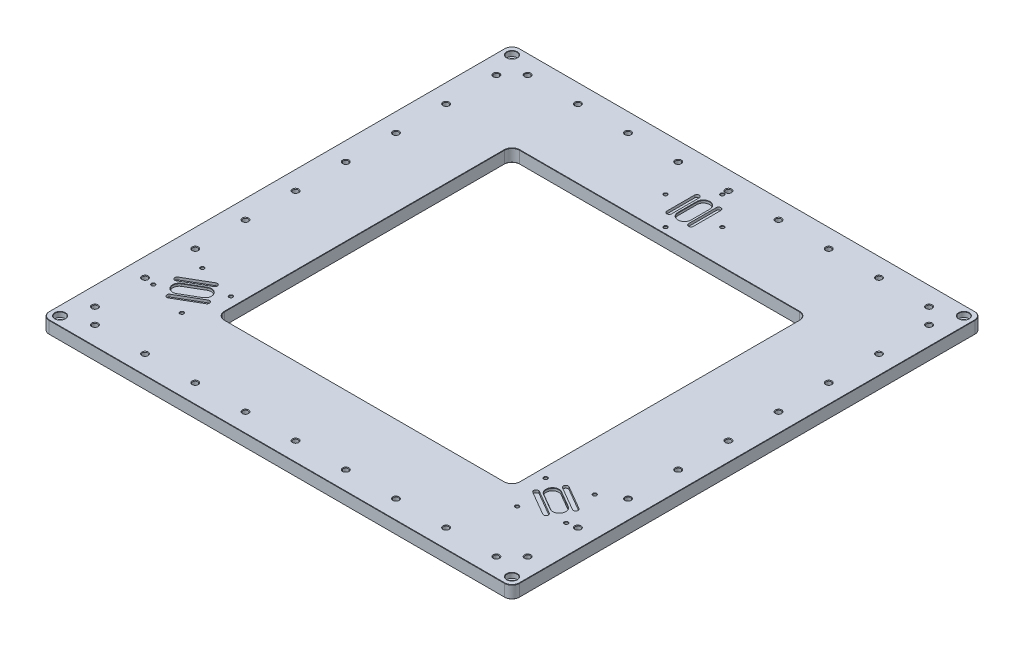
from build123d import *

# Parameters (mm, degrees)
SKETCH1_W                       = 375
SKETCH1_H                       = 375
BOSS_EXTRUDE1_DEPTH             = 10
CBORE_FOR_M4_SHCS1_D            = 4.3
CBORE_FOR_M4_SHCS1_CBORE_D      = 8
CBORE_FOR_M4_SHCS1_CBORE_DEPTH  = 4
M5X0_8_TAPPED_HOLE1_AT_2_COUNT  = 2
M5X0_8_TAPPED_HOLE1_AT_2_PITCH  = 235.279089594
M5X0_8_TAPPED_HOLE1_AT_3_COUNT  = 2
M5X0_8_TAPPED_HOLE1_AT_3_PITCH  = 210.133885892
M5X0_8_TAPPED_HOLE1_AT_4_COUNT  = 2
M5X0_8_TAPPED_HOLE1_AT_4_PITCH  = 190.147968698
M5X0_8_TAPPED_HOLE1_AT_5_COUNT  = 2
M5X0_8_TAPPED_HOLE1_AT_5_PITCH  = 177.07696067
M5X0_8_TAPPED_HOLE1_AT_6_COUNT  = 2
M5X0_8_TAPPED_HOLE1_AT_6_PITCH  = 172.5
M5X0_8_TAPPED_HOLE1_AT_7_COUNT  = 2
M5X0_8_TAPPED_HOLE1_AT_7_PITCH  = 177.07696067
M5X0_8_TAPPED_HOLE1_AT_8_COUNT  = 2
M5X0_8_TAPPED_HOLE1_AT_8_PITCH  = 190.147968698
M5X0_8_TAPPED_HOLE1_AT_9_COUNT  = 2
M5X0_8_TAPPED_HOLE1_AT_9_PITCH  = 210.133885892
M5X0_8_TAPPED_HOLE1_AT_10_COUNT = 2
M5X0_8_TAPPED_HOLE1_AT_10_PITCH = 235.279089594
CIRPATTERN1_COUNT               = 4
CUT_EXTRUDE2_DEPTH              = 2
SKETCH5_W                       = 235
SKETCH5_H                       = 235
CUT_EXTRUDE3_DEPTH              = 10
M3X0_5_TAPPED_HOLE1_D           = 2.5
M3X0_5_TAPPED_HOLE1_CSINK_D     = 3.05
M3X0_5_TAPPED_HOLE1_CSINK_ANGLE = 90
CUT_EXTRUDE4_DEPTH              = 2
FILLET2_R                       = 6
CHAMFER1_SIZE                   = 0.25


with BuildPart() as part:
    # Sketch1 → Boss-Extrude1 (new body)
    with BuildSketch(Plane(origin=(0, 0, 0), x_dir=(1, 0, 0), z_dir=(0, 1, 0))):
        Rectangle(SKETCH1_W, SKETCH1_H)
    extrude(amount=BOSS_EXTRUDE1_DEPTH)

    # CBORE for M4 SHCS1 (through all)
    with Locations(Plane(origin=(0, 10, 0), x_dir=(1, 0, 0), z_dir=(0, 1, 0))):
        with Locations((-180.121825, -180.121825)):
            cbore_for_m4_shcs1 = CounterBoreHole(CBORE_FOR_M4_SHCS1_D / 2, CBORE_FOR_M4_SHCS1_CBORE_D / 2, CBORE_FOR_M4_SHCS1_CBORE_DEPTH)

    # Sketch16 → M5x0.8 Tapped Hole1 (revolve, cut)
    with BuildSketch(Plane(origin=(0, 10, 0), x_dir=(0, 0, 1), z_dir=(1, 0, 0))):
        Polygon((0, 0), (0, 10), (2.525, 10), (2.1, 9.575), (2.1, 0.425), (2.525, 0), align=None)
    m5x0_8_tapped_hole1 = revolve(axis=Axis((0, 16.35, 0), (0, -1, 0)), mode=Mode.SUBTRACT)

    # M5x0.8 Tapped Hole1 at 2: M5x0.8 Tapped Hole1 ×2
    with Locations(*[Vector(-0.6800434338485409, 0, -0.7331718271179581) * (i * M5X0_8_TAPPED_HOLE1_AT_2_PITCH) for i in range(1, M5X0_8_TAPPED_HOLE1_AT_2_COUNT)]):
        add(m5x0_8_tapped_hole1, mode=Mode.SUBTRACT)

    # M5x0.8 Tapped Hole1 at 3: M5x0.8 Tapped Hole1 ×2
    with Locations(*[Vector(-0.5710644881985998, 0, -0.8209052017854872) * (i * M5X0_8_TAPPED_HOLE1_AT_3_PITCH) for i in range(1, M5X0_8_TAPPED_HOLE1_AT_3_COUNT)]):
        add(m5x0_8_tapped_hole1, mode=Mode.SUBTRACT)

    # M5x0.8 Tapped Hole1 at 4: M5x0.8 Tapped Hole1 ×2
    with Locations(*[Vector(-0.42072497827747996, 0, -0.9071882344108162) * (i * M5X0_8_TAPPED_HOLE1_AT_4_PITCH) for i in range(1, M5X0_8_TAPPED_HOLE1_AT_4_COUNT)]):
        add(m5x0_8_tapped_hole1, mode=Mode.SUBTRACT)

    # M5x0.8 Tapped Hole1 at 5: M5x0.8 Tapped Hole1 ×2
    with Locations(*[Vector(-0.22589048201828704, 0, -0.9741527037038629) * (i * M5X0_8_TAPPED_HOLE1_AT_5_PITCH) for i in range(1, M5X0_8_TAPPED_HOLE1_AT_5_COUNT)]):
        add(m5x0_8_tapped_hole1, mode=Mode.SUBTRACT)

    # M5x0.8 Tapped Hole1 at 6: M5x0.8 Tapped Hole1 ×2
    with Locations(*[(0, 0, -i * M5X0_8_TAPPED_HOLE1_AT_6_PITCH) for i in range(1, M5X0_8_TAPPED_HOLE1_AT_6_COUNT)]):
        add(m5x0_8_tapped_hole1, mode=Mode.SUBTRACT)

    # M5x0.8 Tapped Hole1 at 7: M5x0.8 Tapped Hole1 ×2
    with Locations(*[Vector(0.22589048201828704, 0, -0.9741527037038629) * (i * M5X0_8_TAPPED_HOLE1_AT_7_PITCH) for i in range(1, M5X0_8_TAPPED_HOLE1_AT_7_COUNT)]):
        add(m5x0_8_tapped_hole1, mode=Mode.SUBTRACT)

    # M5x0.8 Tapped Hole1 at 8: M5x0.8 Tapped Hole1 ×2
    with Locations(*[Vector(0.42072497827747996, 0, -0.9071882344108162) * (i * M5X0_8_TAPPED_HOLE1_AT_8_PITCH) for i in range(1, M5X0_8_TAPPED_HOLE1_AT_8_COUNT)]):
        add(m5x0_8_tapped_hole1, mode=Mode.SUBTRACT)

    # M5x0.8 Tapped Hole1 at 9: M5x0.8 Tapped Hole1 ×2
    with Locations(*[Vector(0.5710644881985997, 0, -0.8209052017854872) * (i * M5X0_8_TAPPED_HOLE1_AT_9_PITCH) for i in range(1, M5X0_8_TAPPED_HOLE1_AT_9_COUNT)]):
        add(m5x0_8_tapped_hole1, mode=Mode.SUBTRACT)

    # M5x0.8 Tapped Hole1 at 10: M5x0.8 Tapped Hole1 ×2
    with Locations(*[Vector(0.6800434338485409, 0, -0.7331718271179581) * (i * M5X0_8_TAPPED_HOLE1_AT_10_PITCH) for i in range(1, M5X0_8_TAPPED_HOLE1_AT_10_COUNT)]):
        add(m5x0_8_tapped_hole1, mode=Mode.SUBTRACT)

    # CirPattern1: CBORE for M4 SHCS1, M5x0.8 Tapped Hole1 ×4 about axis
    cirpattern1_axis = Axis((0, 0, 0), (0, 1, 0))
    add([cbore_for_m4_shcs1.rotate(cirpattern1_axis, i * 360 / CIRPATTERN1_COUNT) for i in range(1, CIRPATTERN1_COUNT)], mode=Mode.SUBTRACT)
    add([m5x0_8_tapped_hole1.rotate(cirpattern1_axis, i * 360 / CIRPATTERN1_COUNT) for i in range(1, CIRPATTERN1_COUNT)], mode=Mode.SUBTRACT)

    # CirPattern1 copy 1 sketch → CirPattern1 copy 1 (revolve, cut)
    with BuildSketch(Plane(origin=(-172.5, 10, 160), x_dir=(1, 0, 0), z_dir=(0, 0, -1))):
        Polygon((0, 0), (0, 10), (2.525, 10), (2.1, 9.575), (2.1, 0.425), (2.525, 0), align=None)
    revolve(axis=Axis((-172.5, 16.35, 160), (0, -1, 0)), mode=Mode.SUBTRACT)

    # CirPattern1 copy 2 sketch → CirPattern1 copy 2 (revolve, cut)
    with BuildSketch(Plane(origin=(160, 10, 172.5), x_dir=(0, 0, -1), z_dir=(-1, 0, 0))):
        Polygon((0, 0), (0, 10), (2.525, 10), (2.1, 9.575), (2.1, 0.425), (2.525, 0), align=None)
    revolve(axis=Axis((160, 16.35, 172.5), (0, -1, 0)), mode=Mode.SUBTRACT)

    # CirPattern1 copy 3 sketch → CirPattern1 copy 3 (revolve, cut)
    with BuildSketch(Plane(origin=(172.5, 10, -160), x_dir=(-1, 0, 0), z_dir=(0, 0, 1))):
        Polygon((0, 0), (0, 10), (2.525, 10), (2.1, 9.575), (2.1, 0.425), (2.525, 0), align=None)
    revolve(axis=Axis((172.5, 16.35, -160), (0, -1, 0)), mode=Mode.SUBTRACT)

    # CirPattern1 copy 4 sketch → CirPattern1 copy 4 (revolve, cut)
    with BuildSketch(Plane(origin=(-172.5, 10, 120), x_dir=(1, 0, 0), z_dir=(0, 0, -1))):
        Polygon((0, 0), (0, 10), (2.525, 10), (2.1, 9.575), (2.1, 0.425), (2.525, 0), align=None)
    revolve(axis=Axis((-172.5, 16.35, 120), (0, -1, 0)), mode=Mode.SUBTRACT)

    # CirPattern1 copy 5 sketch → CirPattern1 copy 5 (revolve, cut)
    with BuildSketch(Plane(origin=(120, 10, 172.5), x_dir=(0, 0, -1), z_dir=(-1, 0, 0))):
        Polygon((0, 0), (0, 10), (2.525, 10), (2.1, 9.575), (2.1, 0.425), (2.525, 0), align=None)
    revolve(axis=Axis((120, 16.35, 172.5), (0, -1, 0)), mode=Mode.SUBTRACT)

    # CirPattern1 copy 6 sketch → CirPattern1 copy 6 (revolve, cut)
    with BuildSketch(Plane(origin=(172.5, 10, -120), x_dir=(-1, 0, 0), z_dir=(0, 0, 1))):
        Polygon((0, 0), (0, 10), (2.525, 10), (2.1, 9.575), (2.1, 0.425), (2.525, 0), align=None)
    revolve(axis=Axis((172.5, 16.35, -120), (0, -1, 0)), mode=Mode.SUBTRACT)

    # CirPattern1 copy 7 sketch → CirPattern1 copy 7 (revolve, cut)
    with BuildSketch(Plane(origin=(-172.5, 10, 80), x_dir=(1, 0, 0), z_dir=(0, 0, -1))):
        Polygon((0, 0), (0, 10), (2.525, 10), (2.1, 9.575), (2.1, 0.425), (2.525, 0), align=None)
    revolve(axis=Axis((-172.5, 16.35, 80), (0, -1, 0)), mode=Mode.SUBTRACT)

    # CirPattern1 copy 8 sketch → CirPattern1 copy 8 (revolve, cut)
    with BuildSketch(Plane(origin=(80, 10, 172.5), x_dir=(0, 0, -1), z_dir=(-1, 0, 0))):
        Polygon((0, 0), (0, 10), (2.525, 10), (2.1, 9.575), (2.1, 0.425), (2.525, 0), align=None)
    revolve(axis=Axis((80, 16.35, 172.5), (0, -1, 0)), mode=Mode.SUBTRACT)

    # CirPattern1 copy 9 sketch → CirPattern1 copy 9 (revolve, cut)
    with BuildSketch(Plane(origin=(172.5, 10, -80), x_dir=(-1, 0, 0), z_dir=(0, 0, 1))):
        Polygon((0, 0), (0, 10), (2.525, 10), (2.1, 9.575), (2.1, 0.425), (2.525, 0), align=None)
    revolve(axis=Axis((172.5, 16.35, -80), (0, -1, 0)), mode=Mode.SUBTRACT)

    # CirPattern1 copy 10 sketch → CirPattern1 copy 10 (revolve, cut)
    with BuildSketch(Plane(origin=(-172.5, 10, 40), x_dir=(1, 0, 0), z_dir=(0, 0, -1))):
        Polygon((0, 0), (0, 10), (2.525, 10), (2.1, 9.575), (2.1, 0.425), (2.525, 0), align=None)
    revolve(axis=Axis((-172.5, 16.35, 40), (0, -1, 0)), mode=Mode.SUBTRACT)

    # CirPattern1 copy 11 sketch → CirPattern1 copy 11 (revolve, cut)
    with BuildSketch(Plane(origin=(40, 10, 172.5), x_dir=(0, 0, -1), z_dir=(-1, 0, 0))):
        Polygon((0, 0), (0, 10), (2.525, 10), (2.1, 9.575), (2.1, 0.425), (2.525, 0), align=None)
    revolve(axis=Axis((40, 16.35, 172.5), (0, -1, 0)), mode=Mode.SUBTRACT)

    # CirPattern1 copy 12 sketch → CirPattern1 copy 12 (revolve, cut)
    with BuildSketch(Plane(origin=(172.5, 10, -40), x_dir=(-1, 0, 0), z_dir=(0, 0, 1))):
        Polygon((0, 0), (0, 10), (2.525, 10), (2.1, 9.575), (2.1, 0.425), (2.525, 0), align=None)
    revolve(axis=Axis((172.5, 16.35, -40), (0, -1, 0)), mode=Mode.SUBTRACT)

    # CirPattern1 copy 13 sketch → CirPattern1 copy 13 (revolve, cut)
    with BuildSketch(Plane(origin=(-172.5, 10, 0), x_dir=(1, 0, 0), z_dir=(0, 0, -1))):
        Polygon((0, 0), (0, 10), (2.525, 10), (2.1, 9.575), (2.1, 0.425), (2.525, 0), align=None)
    revolve(axis=Axis((-172.5, 16.35, 0), (0, -1, 0)), mode=Mode.SUBTRACT)

    # CirPattern1 copy 14 sketch → CirPattern1 copy 14 (revolve, cut)
    with BuildSketch(Plane(origin=(0, 10, 172.5), x_dir=(0, 0, -1), z_dir=(-1, 0, 0))):
        Polygon((0, 0), (0, 10), (2.525, 10), (2.1, 9.575), (2.1, 0.425), (2.525, 0), align=None)
    revolve(axis=Axis((0, 16.35, 172.5), (0, -1, 0)), mode=Mode.SUBTRACT)

    # CirPattern1 copy 15 sketch → CirPattern1 copy 15 (revolve, cut)
    with BuildSketch(Plane(origin=(172.5, 10, 0), x_dir=(-1, 0, 0), z_dir=(0, 0, 1))):
        Polygon((0, 0), (0, 10), (2.525, 10), (2.1, 9.575), (2.1, 0.425), (2.525, 0), align=None)
    revolve(axis=Axis((172.5, 16.35, 0), (0, -1, 0)), mode=Mode.SUBTRACT)

    # CirPattern1 copy 16 sketch → CirPattern1 copy 16 (revolve, cut)
    with BuildSketch(Plane(origin=(-172.5, 10, -40), x_dir=(1, 0, 0), z_dir=(0, 0, -1))):
        Polygon((0, 0), (0, 10), (2.525, 10), (2.1, 9.575), (2.1, 0.425), (2.525, 0), align=None)
    revolve(axis=Axis((-172.5, 16.35, -40), (0, -1, 0)), mode=Mode.SUBTRACT)

    # CirPattern1 copy 17 sketch → CirPattern1 copy 17 (revolve, cut)
    with BuildSketch(Plane(origin=(-40, 10, 172.5), x_dir=(0, 0, -1), z_dir=(-1, 0, 0))):
        Polygon((0, 0), (0, 10), (2.525, 10), (2.1, 9.575), (2.1, 0.425), (2.525, 0), align=None)
    revolve(axis=Axis((-40, 16.35, 172.5), (0, -1, 0)), mode=Mode.SUBTRACT)

    # CirPattern1 copy 18 sketch → CirPattern1 copy 18 (revolve, cut)
    with BuildSketch(Plane(origin=(172.5, 10, 40), x_dir=(-1, 0, 0), z_dir=(0, 0, 1))):
        Polygon((0, 0), (0, 10), (2.525, 10), (2.1, 9.575), (2.1, 0.425), (2.525, 0), align=None)
    revolve(axis=Axis((172.5, 16.35, 40), (0, -1, 0)), mode=Mode.SUBTRACT)

    # CirPattern1 copy 19 sketch → CirPattern1 copy 19 (revolve, cut)
    with BuildSketch(Plane(origin=(-172.5, 10, -80), x_dir=(1, 0, 0), z_dir=(0, 0, -1))):
        Polygon((0, 0), (0, 10), (2.525, 10), (2.1, 9.575), (2.1, 0.425), (2.525, 0), align=None)
    revolve(axis=Axis((-172.5, 16.35, -80), (0, -1, 0)), mode=Mode.SUBTRACT)

    # CirPattern1 copy 20 sketch → CirPattern1 copy 20 (revolve, cut)
    with BuildSketch(Plane(origin=(-80, 10, 172.5), x_dir=(0, 0, -1), z_dir=(-1, 0, 0))):
        Polygon((0, 0), (0, 10), (2.525, 10), (2.1, 9.575), (2.1, 0.425), (2.525, 0), align=None)
    revolve(axis=Axis((-80, 16.35, 172.5), (0, -1, 0)), mode=Mode.SUBTRACT)

    # CirPattern1 copy 21 sketch → CirPattern1 copy 21 (revolve, cut)
    with BuildSketch(Plane(origin=(172.5, 10, 80), x_dir=(-1, 0, 0), z_dir=(0, 0, 1))):
        Polygon((0, 0), (0, 10), (2.525, 10), (2.1, 9.575), (2.1, 0.425), (2.525, 0), align=None)
    revolve(axis=Axis((172.5, 16.35, 80), (0, -1, 0)), mode=Mode.SUBTRACT)

    # CirPattern1 copy 22 sketch → CirPattern1 copy 22 (revolve, cut)
    with BuildSketch(Plane(origin=(-172.5, 10, -120), x_dir=(1, 0, 0), z_dir=(0, 0, -1))):
        Polygon((0, 0), (0, 10), (2.525, 10), (2.1, 9.575), (2.1, 0.425), (2.525, 0), align=None)
    revolve(axis=Axis((-172.5, 16.35, -120), (0, -1, 0)), mode=Mode.SUBTRACT)

    # CirPattern1 copy 23 sketch → CirPattern1 copy 23 (revolve, cut)
    with BuildSketch(Plane(origin=(-120, 10, 172.5), x_dir=(0, 0, -1), z_dir=(-1, 0, 0))):
        Polygon((0, 0), (0, 10), (2.525, 10), (2.1, 9.575), (2.1, 0.425), (2.525, 0), align=None)
    revolve(axis=Axis((-120, 16.35, 172.5), (0, -1, 0)), mode=Mode.SUBTRACT)

    # CirPattern1 copy 24 sketch → CirPattern1 copy 24 (revolve, cut)
    with BuildSketch(Plane(origin=(172.5, 10, 120), x_dir=(-1, 0, 0), z_dir=(0, 0, 1))):
        Polygon((0, 0), (0, 10), (2.525, 10), (2.1, 9.575), (2.1, 0.425), (2.525, 0), align=None)
    revolve(axis=Axis((172.5, 16.35, 120), (0, -1, 0)), mode=Mode.SUBTRACT)

    # CirPattern1 copy 25 sketch → CirPattern1 copy 25 (revolve, cut)
    with BuildSketch(Plane(origin=(-172.5, 10, -160), x_dir=(1, 0, 0), z_dir=(0, 0, -1))):
        Polygon((0, 0), (0, 10), (2.525, 10), (2.1, 9.575), (2.1, 0.425), (2.525, 0), align=None)
    revolve(axis=Axis((-172.5, 16.35, -160), (0, -1, 0)), mode=Mode.SUBTRACT)

    # CirPattern1 copy 26 sketch → CirPattern1 copy 26 (revolve, cut)
    with BuildSketch(Plane(origin=(-160, 10, 172.5), x_dir=(0, 0, -1), z_dir=(-1, 0, 0))):
        Polygon((0, 0), (0, 10), (2.525, 10), (2.1, 9.575), (2.1, 0.425), (2.525, 0), align=None)
    revolve(axis=Axis((-160, 16.35, 172.5), (0, -1, 0)), mode=Mode.SUBTRACT)

    # CirPattern1 copy 27 sketch → CirPattern1 copy 27 (revolve, cut)
    with BuildSketch(Plane(origin=(172.5, 10, 160), x_dir=(-1, 0, 0), z_dir=(0, 0, 1))):
        Polygon((0, 0), (0, 10), (2.525, 10), (2.1, 9.575), (2.1, 0.425), (2.525, 0), align=None)
    revolve(axis=Axis((172.5, 16.35, 160), (0, -1, 0)), mode=Mode.SUBTRACT)

    # Sketch7 → Cut-Extrude2 (cut)
    with BuildSketch(Plane(origin=(0, 10, 0), x_dir=(1, 0, 0), z_dir=(0, 1, 0))):
        with BuildLine():
            Line((-159.825894542, -106.390125223), (-140.809555822, -95.327627238))
            ThreePointArc((-140.809555822, -95.327627238), (-138.191178047, -96.020013051), (-138.88356386, -98.638390825))
            Line((-138.88356386, -98.638390825), (-157.899902581, -109.700888811))
            ThreePointArc((-157.899902581, -109.700888811), (-160.518280355, -109.008502998), (-159.825894542, -106.390125223))
        make_face()
        with BuildLine():
            Line((-151.11643614, -121.361609175), (-132.100097419, -110.299111189))
            ThreePointArc((-132.100097419, -110.299111189), (-129.481719645, -110.991497002), (-130.174105458, -113.609874777))
            Line((-130.174105458, -113.609874777), (-149.190444178, -124.672372762))
            ThreePointArc((-149.190444178, -124.672372762), (-151.808821953, -123.979986949), (-151.11643614, -121.361609175))
        make_face()
        with BuildLine():
            Line((159.825894542, -106.390125223), (140.809555822, -95.327627238))
            ThreePointArc((140.809555822, -95.327627238), (138.191178047, -96.020013051), (138.88356386, -98.638390825))
            Line((138.88356386, -98.638390825), (157.899902581, -109.700888811))
            ThreePointArc((157.899902581, -109.700888811), (160.518280355, -109.008502998), (159.825894542, -106.390125223))
        make_face()
        with BuildLine():
            Line((151.11643614, -121.361609175), (132.100097419, -110.299111189))
            ThreePointArc((132.100097419, -110.299111189), (129.481719645, -110.991497002), (130.174105458, -113.609874777))
            Line((130.174105458, -113.609874777), (149.190444178, -124.672372762))
            ThreePointArc((149.190444178, -124.672372762), (151.808821953, -123.979986949), (151.11643614, -121.361609175))
        make_face()
        with BuildLine():
            Line((-6.745143, 156), (-6.745143, 134))
            ThreePointArc((-6.745143, 134), (-8.660254, 132.084889), (-10.575365, 134))
            Line((-10.575365, 134), (-10.575365, 156))
            ThreePointArc((-10.575365, 156), (-8.660254, 157.915111), (-6.745143, 156))
        make_face()
        with BuildLine():
            Line((10.575365, 156), (10.575365, 134))
            ThreePointArc((10.575365, 134), (8.660254, 132.084889), (6.745143, 134))
            Line((6.745143, 134), (6.745143, 156))
            ThreePointArc((6.745143, 156), (8.660254, 157.915111), (10.575365, 156))
        make_face()
    extrude(amount=-CUT_EXTRUDE2_DEPTH, mode=Mode.SUBTRACT)

    # Sketch5 → Cut-Extrude3 (cut)
    with BuildSketch(Plane(origin=(0, 10, 0), x_dir=(1, 0, 0), z_dir=(0, 1, 0))):
        Rectangle(SKETCH5_W, SKETCH5_H)
    extrude(amount=-CUT_EXTRUDE3_DEPTH, mode=Mode.SUBTRACT)

    # M3x0.5 Tapped Hole1 (through all)
    with Locations(Plane(origin=(0, 10, 0), x_dir=(1, 0, 0), z_dir=(0, 1, 0))):
        with Locations((-164.558664818, -121.377988861), (-125.441335182, -98.622011139), (125.441335182, -98.622011139), (164.558664818, -121.377988861), (0, 122.372583002), (0, 167.627416998), (-156.377988861, -90.441335182), (-133.622011139, -129.558664818), (133.622011139, -129.558664818), (156.377988861, -90.441335182), (22.627416998, 145), (-22.627416998, 145)):
            CounterSinkHole(M3X0_5_TAPPED_HOLE1_D / 2, M3X0_5_TAPPED_HOLE1_CSINK_D / 2, counter_sink_angle=M3X0_5_TAPPED_HOLE1_CSINK_ANGLE)

    # Sketch14 → Cut-Extrude4 (cut)
    with BuildSketch(Plane(origin=(0, 10, 0), x_dir=(1, 0, 0), z_dir=(0, 1, 0))):
        with BuildLine():
            Line((-153.997046833, -109.449410968), (-141.031361342, -101.906798705))
            ThreePointArc((-141.031361342, -101.906798705), (-134.195262091, -103.714489781), (-136.002953167, -110.550589032))
            Line((-136.002953167, -110.550589032), (-148.968638658, -118.093201295))
            ThreePointArc((-148.968638658, -118.093201295), (-155.804737909, -116.285510219), (-153.997046833, -109.449410968))
        make_face()
        with BuildLine():
            Line((148.968638658, -118.093201295), (136.002953167, -110.550589032))
            ThreePointArc((136.002953167, -110.550589032), (134.195262091, -103.714489781), (141.031361342, -101.906798705))
            Line((141.031361342, -101.906798705), (153.997046833, -109.449410968))
            ThreePointArc((153.997046833, -109.449410968), (155.804737909, -116.285510219), (148.968638658, -118.093201295))
        make_face()
        with BuildLine():
            Line((-5, 137.5), (-5, 152.5))
            ThreePointArc((-5, 152.5), (0, 157.5), (5, 152.5))
            Line((5, 152.5), (5, 137.5))
            ThreePointArc((5, 137.5), (0, 132.5), (-5, 137.5))
        make_face()
    extrude(amount=-CUT_EXTRUDE4_DEPTH, mode=Mode.SUBTRACT)

    # Fillet2
    fillet2_edges = [part.edges().sort_by_distance(p)[0] for p in [
        (117.5, 5, 117.5),
        (117.5, 5, -117.5),
        (-117.5, 5, -117.5),
        (-117.5, 5, 117.5),
        (187.5, 5, 187.5),
        (-187.5, 5, 187.5),
        (-187.5, 5, -187.5),
        (187.5, 5, -187.5),
    ]]
    fillet(fillet2_edges, radius=FILLET2_R)

    # Chamfer1
    chamfer1_edges = [part.edges().sort_by_distance(p)[0] for p in [
        (-180.121825, 10, -184.121825),
        (184.121825, 10, -180.121825),
        (180.121825, 10, 184.121825),
        (-184.121825, 10, 180.121825),
        (-155.804737909, 10, 116.285510219),
        (-142.485795912, 10, 114.321895164),
        (-134.195262091, 10, 103.714489781),
        (-147.514204088, 10, 105.678104836),
        (155.804737909, 10, 116.285510219),
        (147.514204088, 10, 105.678104836),
        (134.195262091, 10, 103.714489781),
        (142.485795912, 10, 114.321895164),
        (0, 10, -132.5),
        (5, 10, -145),
        (0, 10, -157.5),
        (-5, 10, -145),
        (0, 10, 117.5),
        (0, 0, 117.5),
        (-117.5, 10, 0),
        (-117.5, 0, 0),
        (0, 10, -117.5),
        (0, 0, -117.5),
        (117.5, 10, 0),
        (117.5, 0, 0),
        (187.5, 0, 0),
        (187.5, 10, 0),
        (0, 0, 187.5),
        (-187.5, 0, 0),
        (0, 0, -187.5),
        (-185.742640687, 0, -185.742640687),
        (185.742640687, 0, -185.742640687),
        (-185.742640687, 0, 185.742640687),
        (185.742640687, 0, 185.742640687),
        (0, 10, 187.5),
        (0, 10, -187.5),
        (-187.5, 10, 0),
        (-185.742640687, 10, -185.742640687),
        (185.742640687, 10, -185.742640687),
        (-185.742640687, 10, 185.742640687),
        (185.742640687, 10, 185.742640687),
        (-115.742640687, 10, 115.742640687),
        (-115.742640687, 0, 115.742640687),
        (115.742640687, 10, -115.742640687),
        (115.742640687, 0, -115.742640687),
        (115.742640687, 10, 115.742640687),
        (115.742640687, 0, 115.742640687),
        (-115.742640687, 10, -115.742640687),
        (-115.742640687, 0, -115.742640687),
    ]]
    chamfer(chamfer1_edges, length=CHAMFER1_SIZE)


solid = part.part
